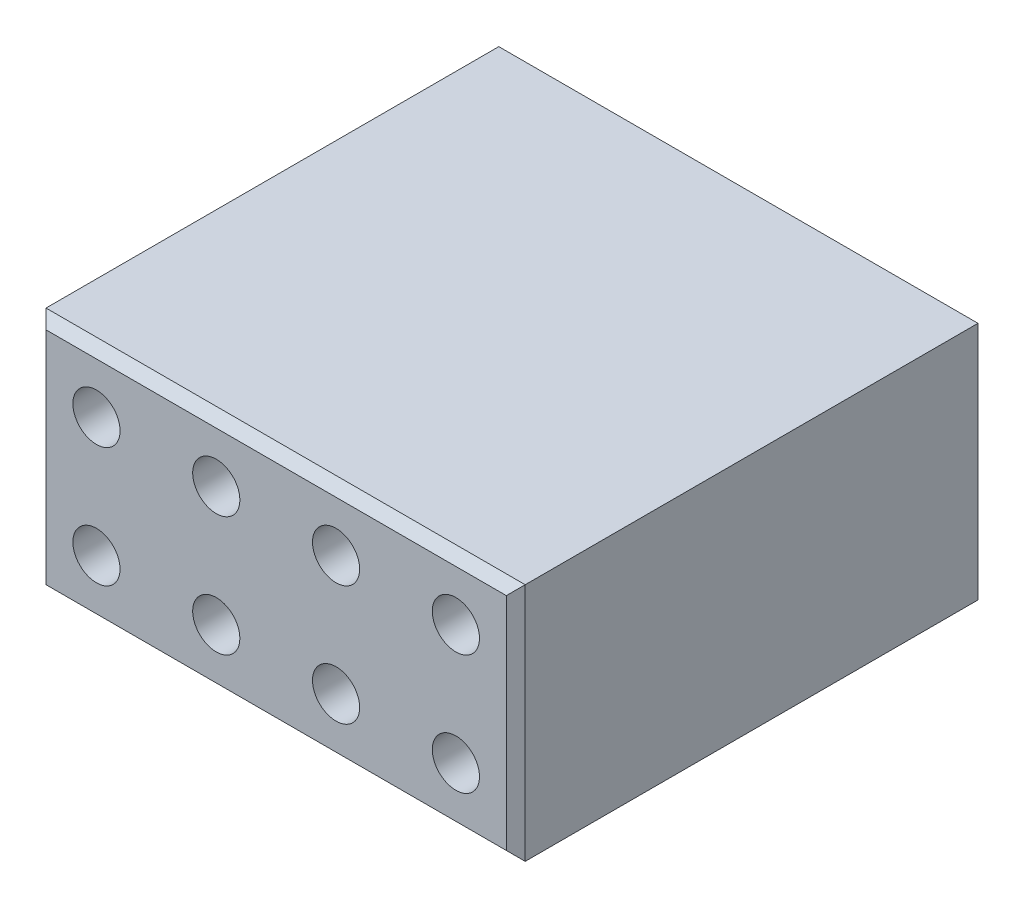
from build123d import *

# Parameters (mm, degrees)
SKETCH1_W           = 10.16
SKETCH1_H           = 5.08
SKETCH1_W_2         = 1
SKETCH1_H_2         = 1
BOSS_EXTRUDE2_DEPTH = 8
SKETCH2_W           = 10.16
SKETCH2_H           = 5.08
SKETCH2_R           = 0.5
BOSS_EXTRUDE3_DEPTH = 2
CHAMFER1_SIZE       = 0.2
CHAMFER2_SIZE       = 0.2


with BuildPart() as part:
    # Sketch1 → Boss-Extrude2 (new body)
    with BuildSketch(Plane.XY):
        Rectangle(SKETCH1_W, SKETCH1_H)
        with Locations((-1.27, 1.27)):
            Rectangle(SKETCH1_W_2, SKETCH1_H_2, mode=Mode.SUBTRACT)
        with Locations((-3.81, 1.27)):
            Rectangle(SKETCH1_W_2, SKETCH1_H_2, mode=Mode.SUBTRACT)
        with Locations((1.27, 1.27)):
            Rectangle(SKETCH1_W_2, SKETCH1_H_2, mode=Mode.SUBTRACT)
        with Locations((3.81, 1.27)):
            Rectangle(SKETCH1_W_2, SKETCH1_H_2, mode=Mode.SUBTRACT)
        with Locations((-1.27, -1.27)):
            Rectangle(SKETCH1_W_2, SKETCH1_H_2, mode=Mode.SUBTRACT)
        with Locations((1.27, -1.27)):
            Rectangle(SKETCH1_W_2, SKETCH1_H_2, mode=Mode.SUBTRACT)
        with Locations((3.81, -1.27)):
            Rectangle(SKETCH1_W_2, SKETCH1_H_2, mode=Mode.SUBTRACT)
        with Locations((-3.81, -1.27)):
            Rectangle(SKETCH1_W_2, SKETCH1_H_2, mode=Mode.SUBTRACT)
    extrude(amount=BOSS_EXTRUDE2_DEPTH)

    # Sketch2 → Boss-Extrude3 (add)
    with BuildSketch(Plane.XY.offset(8)):
        Rectangle(SKETCH2_W, SKETCH2_H)
        with Locations((-3.81, 1.27)):
            Circle(SKETCH2_R, mode=Mode.SUBTRACT)
        with Locations((-1.27, 1.27)):
            Circle(SKETCH2_R, mode=Mode.SUBTRACT)
        with Locations((1.27, 1.27)):
            Circle(SKETCH2_R, mode=Mode.SUBTRACT)
        with Locations((3.81, 1.27)):
            Circle(SKETCH2_R, mode=Mode.SUBTRACT)
        with Locations((-1.27, -1.27)):
            Circle(SKETCH2_R, mode=Mode.SUBTRACT)
        with Locations((1.27, -1.27)):
            Circle(SKETCH2_R, mode=Mode.SUBTRACT)
        with Locations((3.81, -1.27)):
            Circle(SKETCH2_R, mode=Mode.SUBTRACT)
        with Locations((-3.81, -1.27)):
            Circle(SKETCH2_R, mode=Mode.SUBTRACT)
    extrude(amount=BOSS_EXTRUDE3_DEPTH)

    # Chamfer1
    chamfer1_edges = [part.edges().sort_by_distance(p)[0] for p in [
        (-3.81, -0.77, 0),
        (-3.31, -1.27, 0),
        (-3.81, -1.77, 0),
        (-4.31, -1.27, 0),
        (1.27, -0.77, 0),
        (1.77, -1.27, 0),
        (1.27, -1.77, 0),
        (0.77, -1.27, 0),
        (3.81, 1.77, 0),
        (4.31, 1.27, 0),
        (3.81, 0.77, 0),
        (3.31, 1.27, 0),
        (-1.27, 1.77, 0),
        (-0.77, 1.27, 0),
        (-1.27, 0.77, 0),
        (-1.77, 1.27, 0),
        (0, -2.54, 0),
        (5.08, 0, 0),
        (0, 2.54, 0),
        (-5.08, 0, 0),
        (-3.81, 1.77, 0),
        (-3.31, 1.27, 0),
        (-3.81, 0.77, 0),
        (-4.31, 1.27, 0),
        (1.27, 1.77, 0),
        (1.77, 1.27, 0),
        (1.27, 0.77, 0),
        (0.77, 1.27, 0),
        (-1.27, -0.77, 0),
        (-0.77, -1.27, 0),
        (-1.27, -1.77, 0),
        (-1.77, -1.27, 0),
        (3.81, -0.77, 0),
        (4.31, -1.27, 0),
        (3.81, -1.77, 0),
        (3.31, -1.27, 0),
    ]]
    chamfer(chamfer1_edges, length=CHAMFER1_SIZE)

    # Chamfer2
    chamfer2_edges = [part.edges().sort_by_distance(p)[0] for p in [
        (5.08, 0, 10),
        (0, -2.54, 10),
        (-5.08, 0, 10),
        (0, 2.54, 10),
    ]]
    chamfer(chamfer2_edges, length=CHAMFER2_SIZE)


solid = part.part
